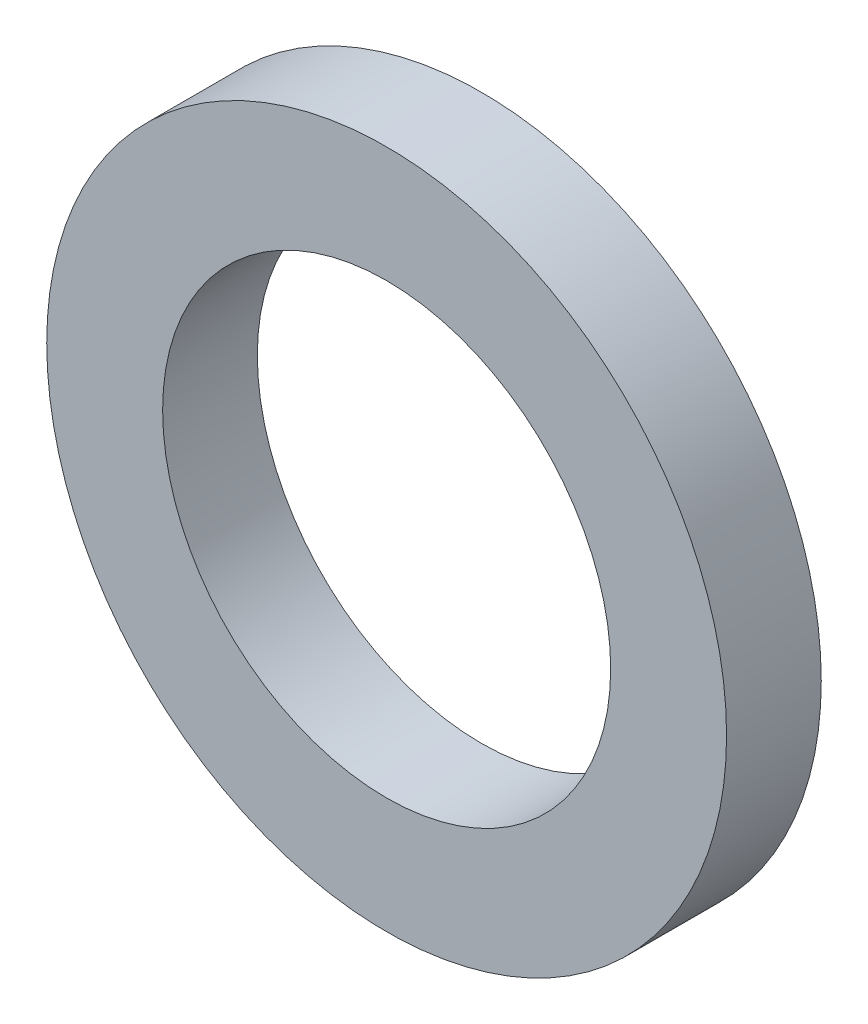
from build123d import *

# Parameters (mm, degrees)
SKETCH1_R           = 12.2174
SKETCH1_R_2         = 8.0518
BOSS_EXTRUDE1_DEPTH = 3.4036


with BuildPart() as part:
    # Sketch1 → Boss-Extrude1 (new body)
    with BuildSketch(Plane.XY):
        Circle(SKETCH1_R)
        Circle(SKETCH1_R_2, mode=Mode.SUBTRACT)
    extrude(amount=-BOSS_EXTRUDE1_DEPTH)


solid = part.part
